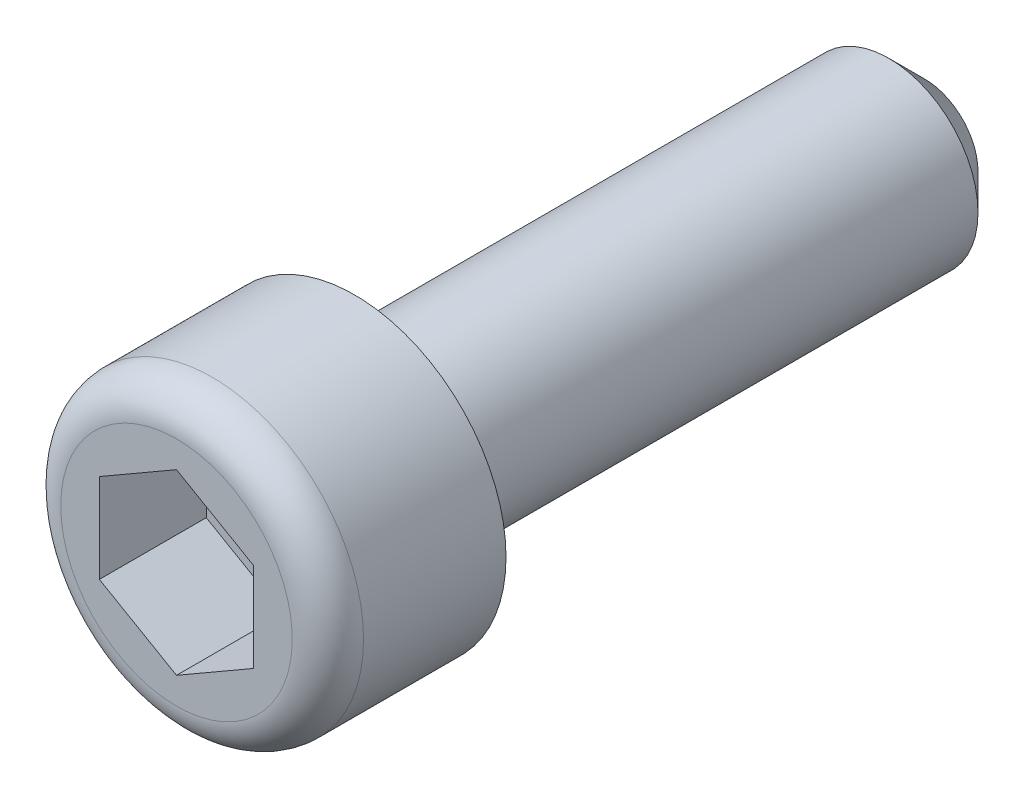
from build123d import *

# Parameters (mm, degrees)
FOOTPRINT_DEPTH = 3
CHAMFER1_SIZE   = 1
FILLET1_R       = 1


with BuildPart() as part:
    # Sketch1 → Body (revolve)
    with BuildSketch(Plane(origin=(0, 0, 0), x_dir=(0, 0, -1), z_dir=(1, 0, 0)), mode=Mode.PRIVATE) as body_sk:
        Polygon((0, 0), (0, 4.25), (5, 4.25), (5, 2.5), (21, 2.5), (21, 0), align=None)
    revolve(body_sk.sketch.rotate(Axis((0, 0, 156.291575099), (0, 0, -1)), 90), axis=Axis((0, 0, 156.291575099), (0, 0, -1)))

    # Sketch2 → Footprint (cut)
    with BuildSketch(Plane.XY):
        Polygon((0, 2.5), (-2.165063509, 1.25), (-2.165063509, -1.25), (0, -2.5), (2.165063509, -1.25), (2.165063509, 1.25), align=None)
    extrude(amount=-FOOTPRINT_DEPTH, mode=Mode.SUBTRACT)

    # Chamfer1
    chamfer1_edges = [part.edges().sort_by_distance(p)[0] for p in [
        (-2.5, 0, -21),
    ]]
    chamfer(chamfer1_edges, length=CHAMFER1_SIZE)

    # Fillet1
    fillet1_edges = [part.edges().sort_by_distance(p)[0] for p in [
        (-4.25, 0, 0),
    ]]
    fillet(fillet1_edges, radius=FILLET1_R)


solid = part.part
